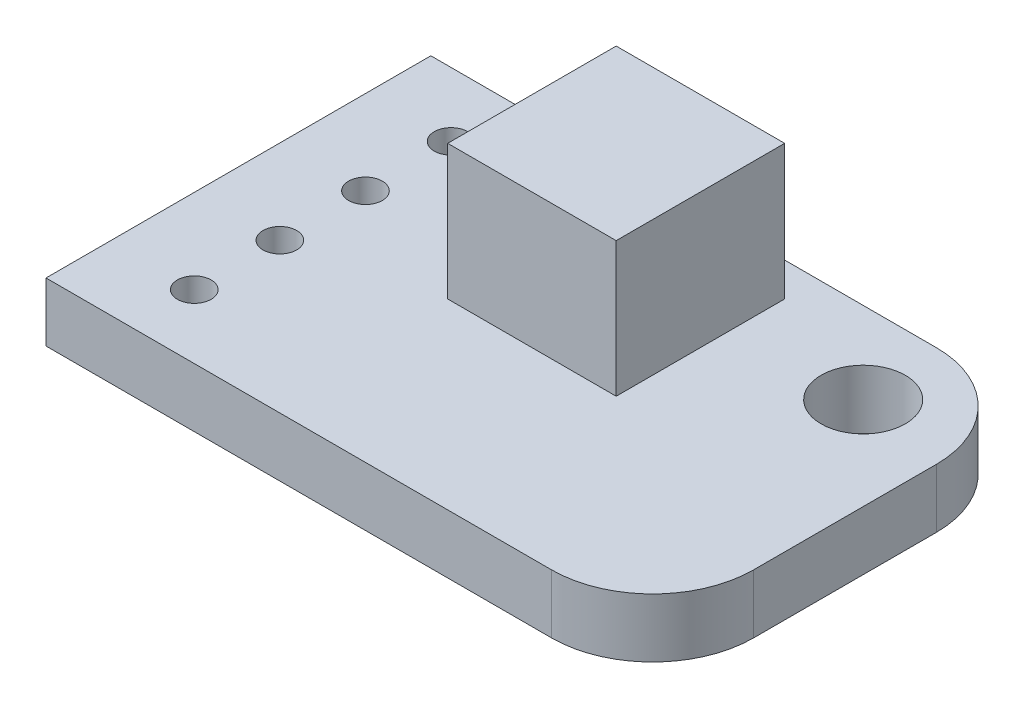
from build123d import *

# Parameters (mm, degrees)
SKETCH1_R           = 1.25
SKETCH1_R_2         = 0.5
BOSS_EXTRUDE1_DEPTH = 0.875
SKETCH2_W           = 5
SKETCH2_H           = 5
BOSS_EXTRUDE2_DEPTH = 4


with BuildPart() as part:
    # Sketch1 → Boss-Extrude1 (new, symmetric)
    with BuildSketch(Plane(origin=(0, 0, 0), x_dir=(1, 0, 0), z_dir=(0, 1, 0))):
        with BuildLine():
            Line((-7.5, 5.71), (7.5, 5.71))
            ThreePointArc((7.5, 5.71), (9.621320344, 4.831320344), (10.5, 2.71))
            Line((10.5, 2.71), (10.5, -2.71))
            ThreePointArc((10.5, -2.71), (9.621320344, -4.831320344), (7.5, -5.71))
            Line((7.5, -5.71), (-7.5, -5.71))
            Line((-7.5, -5.71), (-7.5, 5.71))
        make_face()
        with Locations(Location((7.75, 3.29, 0), (0, 0, 270))):
            Circle(SKETCH1_R, mode=Mode.SUBTRACT)
        with Locations(Location((-5, 3.81, 0), (0, 0, 270))):
            Circle(SKETCH1_R_2, mode=Mode.SUBTRACT)
        with Locations(Location((-5, 1.27, 0), (0, 0, 270))):
            Circle(SKETCH1_R_2, mode=Mode.SUBTRACT)
        with Locations(Location((-5, -1.27, 0), (0, 0, 270))):
            Circle(SKETCH1_R_2, mode=Mode.SUBTRACT)
        with Locations(Location((-5, -3.81, 0), (0, 0, 270))):
            Circle(SKETCH1_R_2, mode=Mode.SUBTRACT)
    extrude(amount=BOSS_EXTRUDE1_DEPTH, both=True)

    # Sketch2 → Boss-Extrude2 (add)
    with BuildSketch(Plane(origin=(0, 0.875, 0), x_dir=(1, 0, 0), z_dir=(0, 1, 0))):
        with Locations((1.5, 2.21)):
            Rectangle(SKETCH2_W, SKETCH2_H)
    extrude(amount=BOSS_EXTRUDE2_DEPTH)


solid = part.part
